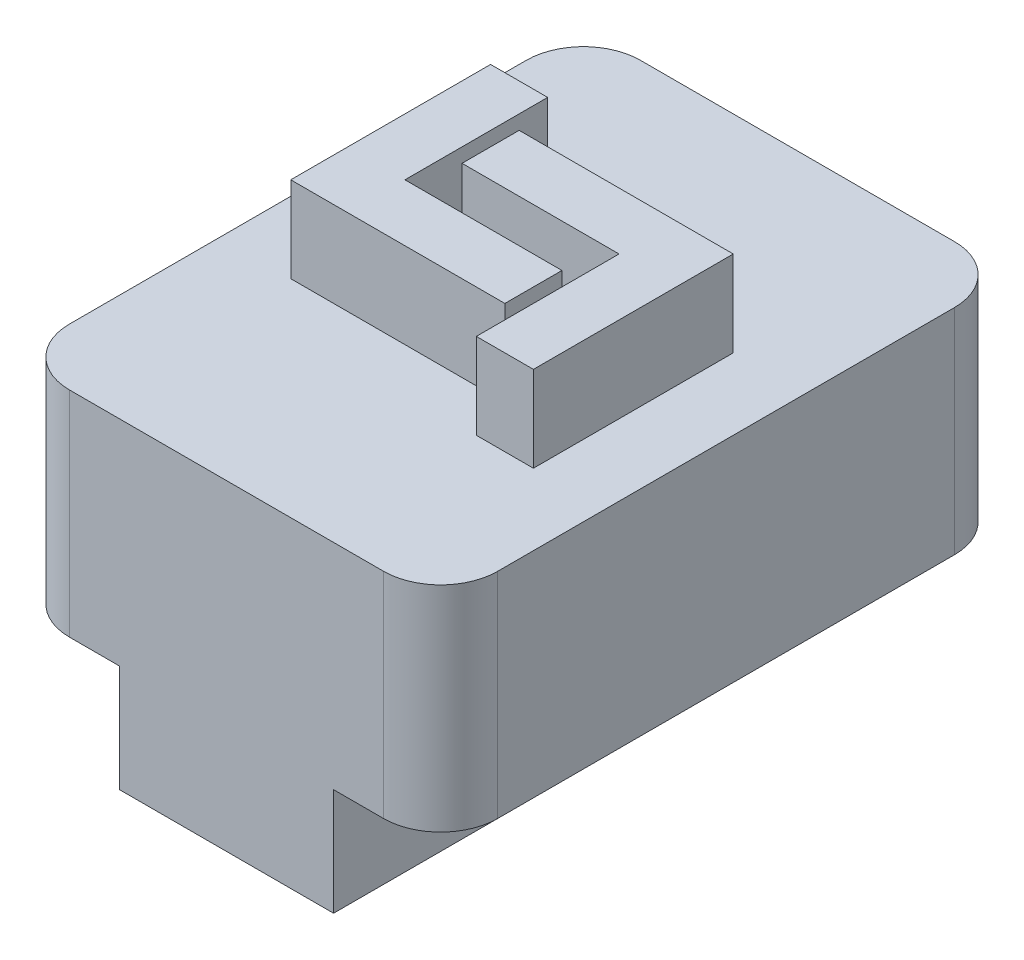
from build123d import *

# Parameters (mm, degrees)
SKETCH_1_W          = 60
SKETCH_1_H          = 45
EXTRUDE_1_DEPTH     = 80
FILLET_1_R          = 8
SKETCH_2_W          = 15
SKETCH_2_H          = 15
CUT_EXTRUDE_1_DEPTH = 110.658560997
SKETCH_3_R          = 2.5
CUT_EXTRUDE_2_DEPTH = 5
EXTRUDE_2_DEPTH     = 12


with BuildPart() as part:
    # ｽｹｯﾁ1 → 押し出し1 (new body)
    with BuildSketch(Plane.XY):
        with Locations((30, 22.5)):
            Rectangle(SKETCH_1_W, SKETCH_1_H)
    extrude(amount=EXTRUDE_1_DEPTH)

    # ﾌｨﾚｯﾄ1
    fillet_1_edges = [part.edges().sort_by_distance(p)[0] for p in [
        (60, 22.5, 80),
        (0, 22.5, 80),
        (60, 22.5, 0),
        (0, 22.5, 0),
    ]]
    fillet(fillet_1_edges, radius=FILLET_1_R)

    # ｽｹｯﾁ2 → ｶｯﾄ - 押し出し1 (cut, through all)
    with BuildSketch(Plane.XY.offset(80)):
        with Locations((52.5, 7.5)):
            Rectangle(SKETCH_2_W, SKETCH_2_H)
        with Locations((7.5, 7.5)):
            Rectangle(SKETCH_2_W, SKETCH_2_H)
    extrude(amount=-CUT_EXTRUDE_1_DEPTH, mode=Mode.SUBTRACT)

    # ｽｹｯﾁ3 → ｶｯﾄ - 押し出し2 (cut)
    with BuildSketch(Plane.XZ):
        with Locations(Location((41.136931804, 51.136931804, 0), (0, 0, 270))):
            Circle(SKETCH_3_R)
        with Locations(Location((41.136931804, 28.863068196, 0), (0, 0, 270))):
            Circle(SKETCH_3_R)
        with Locations(Location((18.863068196, 51.136931804, 0), (0, 0, 270))):
            Circle(SKETCH_3_R)
        with Locations(Location((18.863068196, 28.863068196, 0), (0, 0, 270))):
            Circle(SKETCH_3_R)
    extrude(amount=-CUT_EXTRUDE_2_DEPTH, mode=Mode.SUBTRACT)

    # ｽｹｯﾁ4 → 押し出し2 (add)
    with BuildSketch(Plane(origin=(0, 45, 0), x_dir=(-1, 0, 0), z_dir=(0, 1, 0))):
        Polygon((-50, 29), (-20, 29), (-20, 37), (-42, 37), (-42, 57), (-50, 57), align=None)
        Polygon((-10, 23), (-10, 51), (-40, 51), (-40, 43), (-18, 43), (-18, 23), align=None)
    extrude(amount=EXTRUDE_2_DEPTH)


solid = part.part
